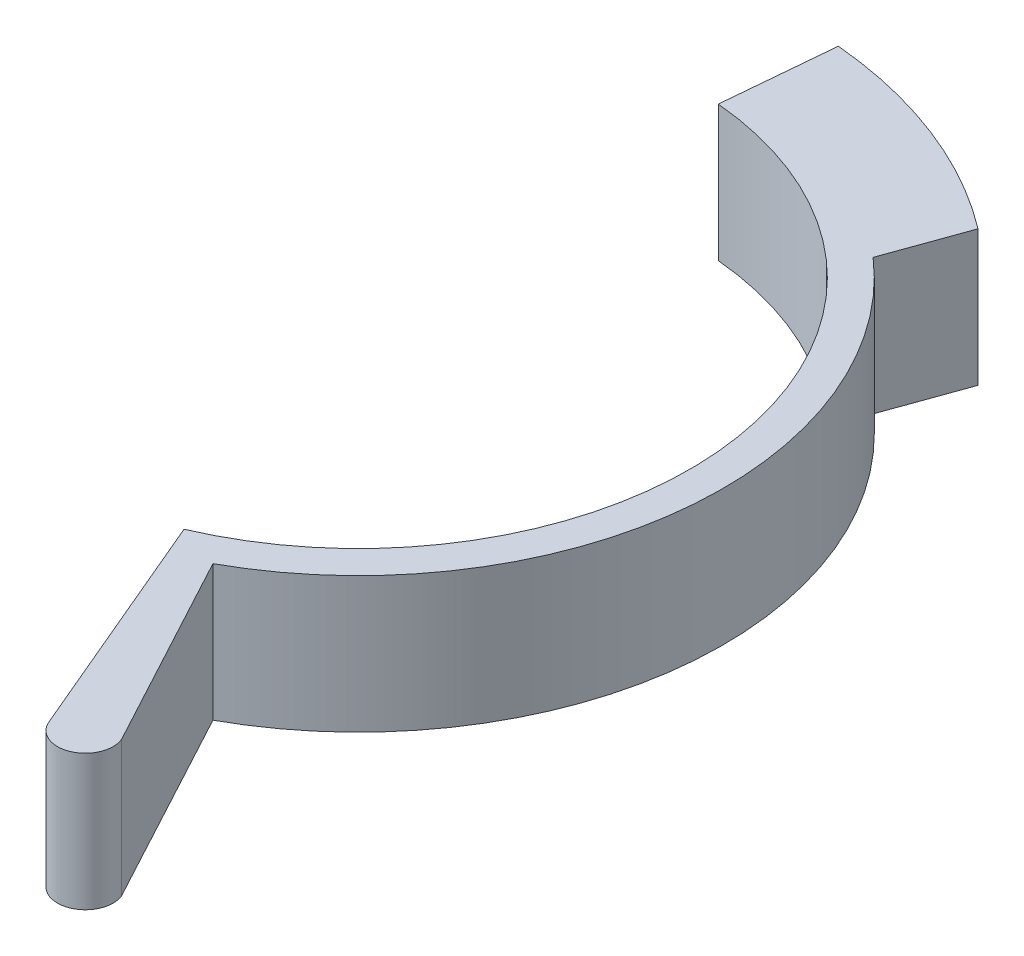
from build123d import *

# Parameters (mm, degrees)
RESSALTO_EXTRUS_O1_DEPTH = 12.26


with BuildPart() as part:
    # Esboço1 → Ressalto-extrusão1 (new body)
    with BuildSketch(Plane(origin=(0, 0, 0), x_dir=(1, 0, 0), z_dir=(0, 1, 0))):
        with BuildLine():
            ThreePointArc((27.862912529, -17.68214086), (32.657820254, 4.739913109), (21.6864187, 24.873665672))
            Line((21.6864187, 24.873665672), (24.193905015, 31.85365959))
            ThreePointArc((24.193905015, 31.85365959), (14.449004884, 37.299154508), (3.578740021, 39.839594489))
            Line((3.578740021, 39.839594489), (2.684054455, 29.879689618))
            ThreePointArc((2.684054455, 29.879689618), (29.627442083, 4.713244699), (11.823645173, -27.571750304))
            Line((11.823645173, -27.571750304), (12.993920826, -30.334106573))
            Line((12.993920826, -30.334106573), (20.795690346, -48.749654144))
            ThreePointArc((20.795690346, -48.749654144), (24.072464244, -50.130779062), (25.453589161, -46.854005164))
            Line((25.453589161, -46.854005164), (25.198608413, -46.380200094))
            Line((25.198608413, -46.380200094), (15.823293166, -28.958995034))
            ThreePointArc((15.823293166, -28.958995034), (21.396881696, -25.123165678), (26.071005915, -20.231229586))
            ThreePointArc((26.071005915, -20.231229586), (26.997061933, -18.977846216), (27.862912529, -17.68214086))
        make_face()
    extrude(amount=RESSALTO_EXTRUS_O1_DEPTH)


solid = part.part
